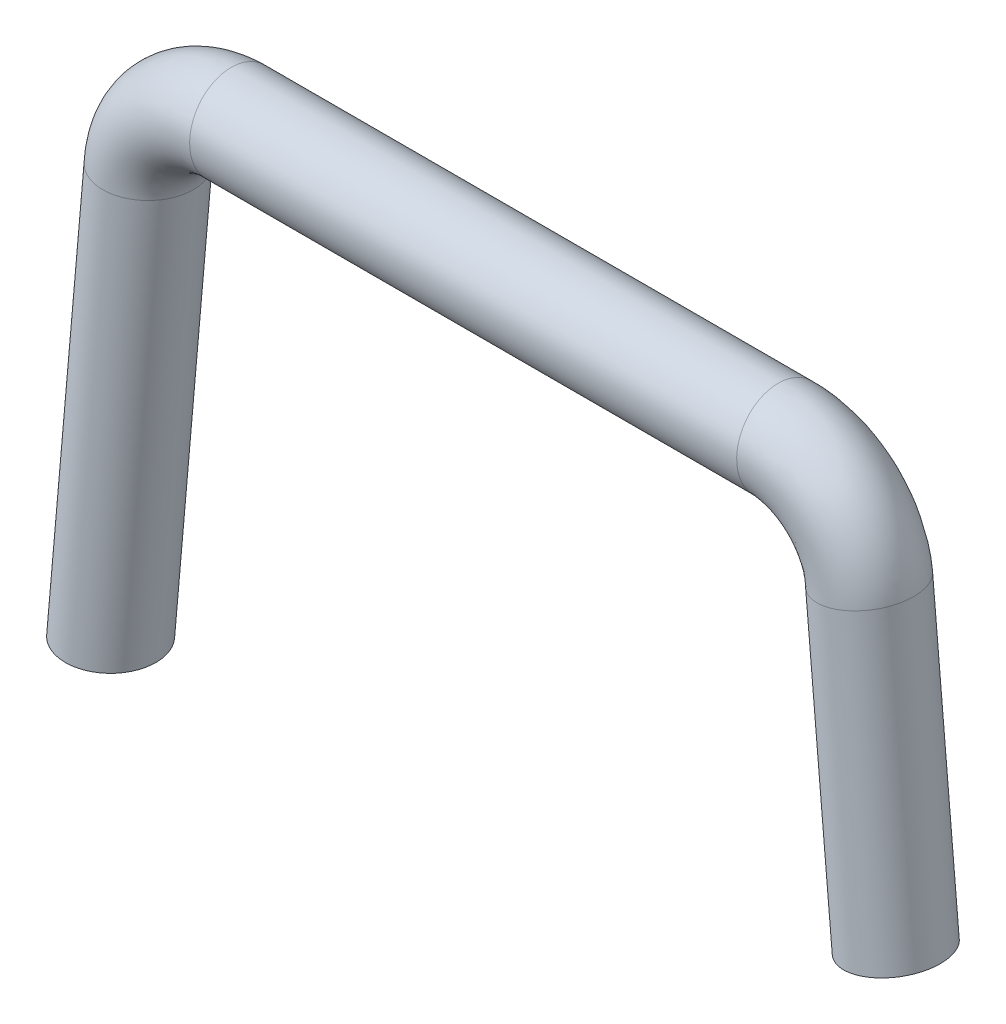
from build123d import *

# Parameters (mm, degrees)
PATH_R = 7


with BuildPart() as part:
    # Cam Handle: sweep along a path in Circle
    with BuildLine(Plane.XY) as cam_handle_path:
        Line((0, 0), (5.789702512, 66.176602527))
        ThreePointArc((5.789702512, 66.176602527), (10.117863133, 74.953244047), (19.238330936, 78.5))
        Line((19.238330936, 78.5), (103.782702537, 78.5))
        ThreePointArc((103.782702537, 78.5), (112.90317034, 74.953244047), (117.231330962, 66.176602527))
        Line((117.231330962, 66.176602527), (121.35, 19.1))
    # Path → Cam Handle (sweep)
    with BuildSketch(Plane(origin=(0, 0, 0), x_dir=(1, 0, 0), z_dir=(0, 1, 0))):
        Circle(PATH_R)
    sweep(path=cam_handle_path.line)


solid = part.part
